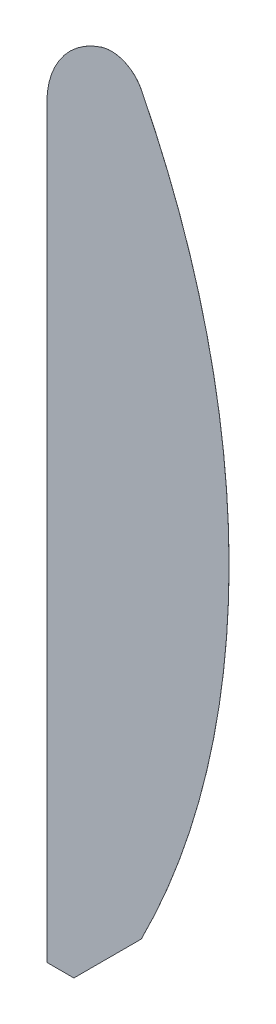
from build123d import *

# Parameters (mm, degrees)
BOSS_EXTRUDE1_DEPTH = 0.01


with BuildPart() as part:
    # Sketch1 → Boss-Extrude1 (new body)
    with BuildSketch(Plane(origin=(0, 0, 0), x_dir=(0, 1, 0), z_dir=(0, 0, 1))):
        with BuildLine():
            Line((0, 0), (138.168, 0))
            ThreePointArc((138.168, 0), (146.702111319, -2.761828424), (152, -10))
            ThreePointArc((152, -10), (151.84245871, -14.324630773), (148.90234292, -17.5))
            ThreePointArc((148.90234292, -17.5), (80.70117146, -33.777777778), (12.5, -17.5))
            Line((12.5, -17.5), (0, -5))
            Line((0, -5), (0, 0))
        make_face()
    extrude(amount=BOSS_EXTRUDE1_DEPTH)


solid = part.part
